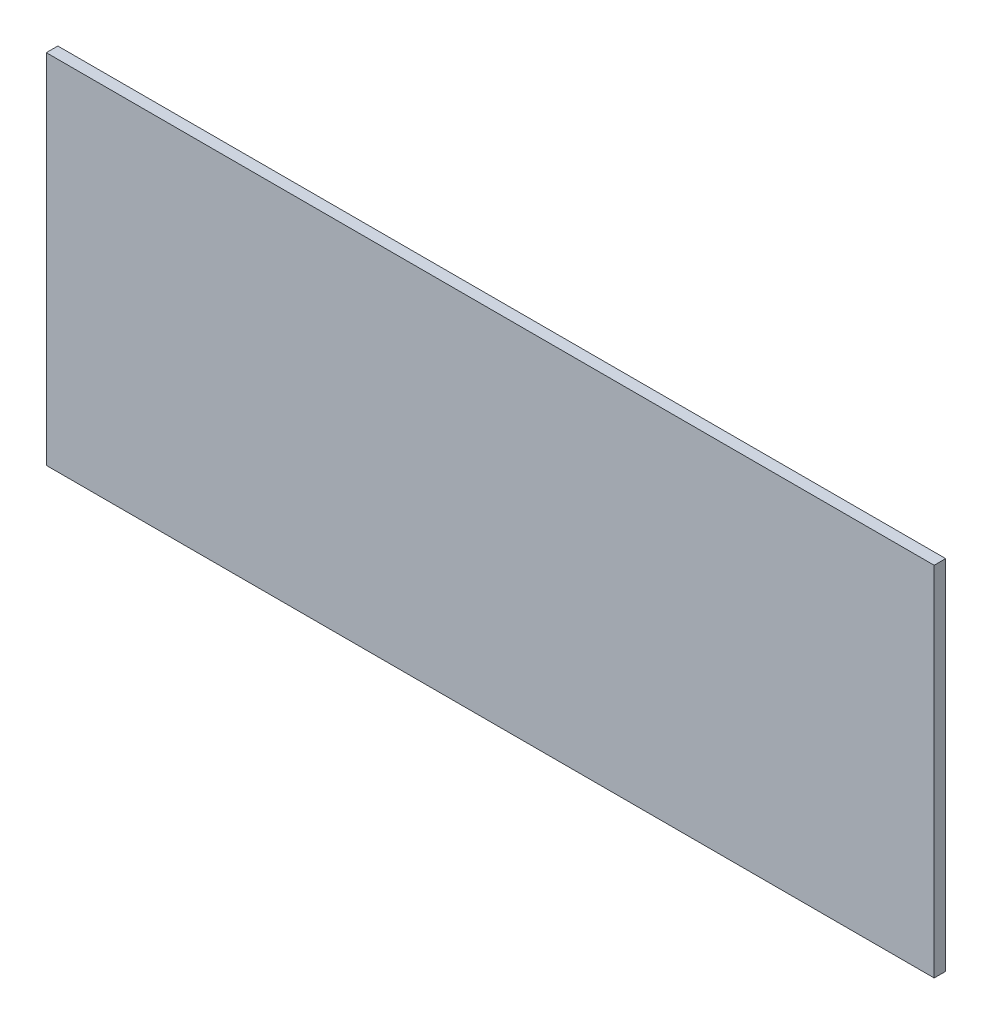
from build123d import *

# Parameters (mm, degrees)
SKETCH1_W           = 154
SKETCH1_H           = 62
BOSS_EXTRUDE1_DEPTH = 2


with BuildPart() as part:
    # Sketch1 → Boss-Extrude1 (new body)
    with BuildSketch(Plane.XY):
        with Locations((77, -31)):
            Rectangle(SKETCH1_W, SKETCH1_H)
    extrude(amount=BOSS_EXTRUDE1_DEPTH)


solid = part.part
